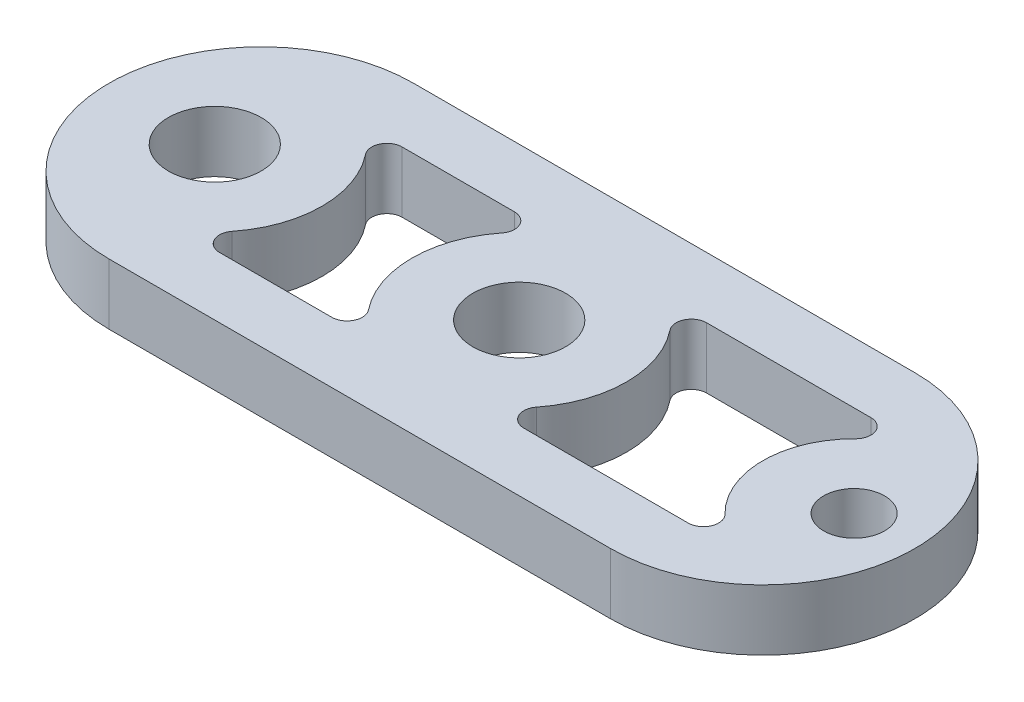
from build123d import *

# Parameters (mm, degrees)
SKETCH1_R           = 2
SKETCH1_R_2         = 3.05
BOSS_EXTRUDE1_DEPTH = 4


with BuildPart() as part:
    # Sketch1 → Boss-Extrude1 (new body)
    with BuildSketch(Plane(origin=(0, 0, 0), x_dir=(1, 0, 0), z_dir=(0, 1, 0))):
        with BuildLine():
            Line((3.05, 10), (36, 10))
            ThreePointArc((36, 10), (46, 0), (36, -10))
            Line((36, -10), (3.05, -10))
            ThreePointArc((3.05, -10), (-6.95, 0), (3.05, 10))
        make_face()
        with Locations(Location((42, 0, 0), (0, 0, 270))):
            Circle(SKETCH1_R, mode=Mode.SUBTRACT)
        with Locations(Location((0, 0, 0), (0, 0, 270))):
            Circle(SKETCH1_R_2, mode=Mode.SUBTRACT)
        with Locations(Location((20, 0, 0), (0, 0, 270))):
            Circle(SKETCH1_R_2, mode=Mode.SUBTRACT)
        with BuildLine():
            Line((26.308922253, -6), (37.101020514, -6))
            ThreePointArc((37.101020514, -6), (38.026840614, -5.377964473), (37.800874727, -4.285714286))
            ThreePointArc((37.800874727, -4.285714286), (36, 0), (37.800874727, 4.285714286))
            ThreePointArc((37.800874727, 4.285714286), (38.026840614, 5.377964473), (37.101020514, 6))
            Line((37.101020514, 6), (26.308922253, 6))
            ThreePointArc((26.308922253, 6), (25.408611748, 5.435248198), (25.525205203, 4.378881988))
            ThreePointArc((25.525205203, 4.378881988), (27.05, 0), (25.525205203, -4.378881988))
            ThreePointArc((25.525205203, -4.378881988), (25.408611748, -5.435248198), (26.308922253, -6))
        make_face(mode=Mode.SUBTRACT)
        with BuildLine():
            Line((6.308922253, 6), (13.691077747, 6))
            ThreePointArc((13.691077747, 6), (14.591388252, 5.435248198), (14.474794797, 4.378881988))
            ThreePointArc((14.474794797, 4.378881988), (12.95, 0), (14.474794797, -4.378881988))
            ThreePointArc((14.474794797, -4.378881988), (14.591388252, -5.435248198), (13.691077747, -6))
            Line((13.691077747, -6), (6.308922253, -6))
            ThreePointArc((6.308922253, -6), (5.408611748, -5.435248198), (5.525205203, -4.378881988))
            ThreePointArc((5.525205203, -4.378881988), (7.05, 0), (5.525205203, 4.378881988))
            ThreePointArc((5.525205203, 4.378881988), (5.408611748, 5.435248198), (6.308922253, 6))
        make_face(mode=Mode.SUBTRACT)
    extrude(amount=BOSS_EXTRUDE1_DEPTH)


solid = part.part
